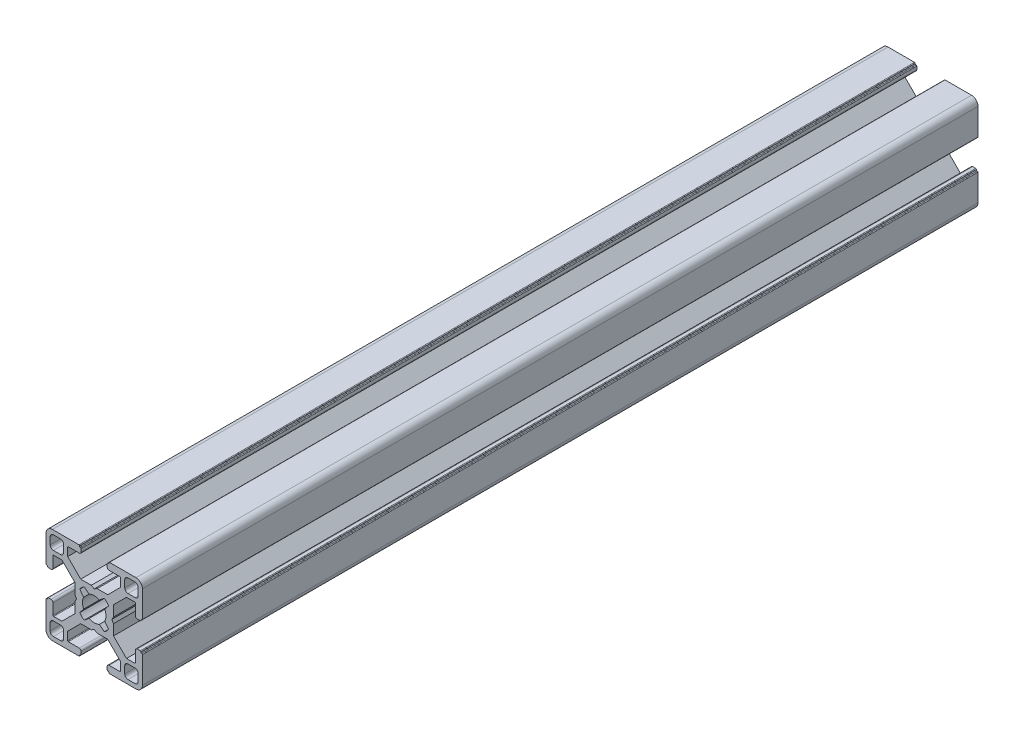
from build123d import *

# Parameters (mm, degrees)
BASE_EXTRUDE_DEPTH = 260


with BuildPart() as part:
    # Sketch1 → Base-Extrude (new body)
    with BuildSketch(Plane.XY):
        with BuildLine():
            Line((6.00446543, 0.899999619), (5.484852164, 0))
            Line((5.484852164, 0), (6.00446543, -0.899999619))
            Line((6.00446543, -0.899999619), (6.00446543, -4.204465866))
            Line((6.00446543, -4.204465866), (10.049999564, -8.25))
            Line((10.049999564, -8.25), (12.59999928, -8.25))
            ThreePointArc((12.59999928, -8.25), (12.741420837, -8.191421273), (12.799999564, -8.049999716))
            Line((12.799999564, -8.049999716), (12.799999564, -4.649999613))
            ThreePointArc((12.799999564, -4.649999613), (12.975735606, -4.225735278), (13.39999994, -4.049999237))
            Line((13.39999994, -4.049999237), (14.300000043, -4.049999237))
            ThreePointArc((14.300000043, -4.049999237), (14.4414216, -4.108577964), (14.500000327, -4.249999521))
            Line((14.500000327, -4.249999521), (14.500000327, -4.349998953))
            ThreePointArc((14.500000327, -4.349998953), (14.558579054, -4.49142051), (14.700000611, -4.549999237))
            Line((14.700000611, -4.549999237), (14.799999716, -4.549999237))
            ThreePointArc((14.799999716, -4.549999237), (14.941421273, -4.608577964), (15, -4.749999521))
            Line((15, -4.749999521), (15, -13.000000346))
            ThreePointArc((15, -13.000000346), (14.414213664, -14.414213664), (13.000000346, -15))
            Line((13.000000346, -15), (4.749999945, -15))
            ThreePointArc((4.749999945, -15), (4.60857832, -14.941421245), (4.549999564, -14.799999619))
            Line((4.549999564, -14.799999619), (4.549999564, -14.69999942))
            ThreePointArc((4.549999564, -14.69999942), (4.49142109, -14.558578474), (4.350000144, -14.5))
            Line((4.350000144, -14.5), (4.250000374, -14.5))
            ThreePointArc((4.250000374, -14.5), (4.108578753, -14.441421247), (4.05, -14.299999626))
            Line((4.05, -14.299999626), (4.05, -13.399999434))
            ThreePointArc((4.05, -13.399999434), (4.225735989, -12.975735226), (4.650000197, -12.799999237))
            Line((4.650000197, -12.799999237), (8.049999924, -12.799999237))
            ThreePointArc((8.049999924, -12.799999237), (8.191421565, -12.741420475), (8.250000327, -12.599998834))
            Line((8.250000327, -12.599998834), (8.250000327, -10.049999237))
            Line((8.250000327, -10.049999237), (4.204466193, -6))
            Line((4.204466193, -6), (0.899999946, -6))
            Line((0.899999946, -6), (0, -5.484851837))
            Line((0, -5.484851837), (-0.899999946, -6))
            Line((-0.899999946, -6), (-4.204466193, -6))
            Line((-4.204466193, -6), (-8.250000327, -10.049999237))
            Line((-8.250000327, -10.049999237), (-8.250000327, -12.599998834))
            ThreePointArc((-8.250000327, -12.599998834), (-8.191421565, -12.741420475), (-8.049999924, -12.799999237))
            Line((-8.049999924, -12.799999237), (-4.650000197, -12.799999237))
            ThreePointArc((-4.650000197, -12.799999237), (-4.225735989, -12.975735226), (-4.05, -13.399999434))
            Line((-4.05, -13.399999434), (-4.05, -14.299999626))
            ThreePointArc((-4.05, -14.299999626), (-4.108578753, -14.441421247), (-4.250000374, -14.5))
            Line((-4.250000374, -14.5), (-4.350000144, -14.5))
            ThreePointArc((-4.350000144, -14.5), (-4.49142109, -14.558578474), (-4.549999564, -14.69999942))
            Line((-4.549999564, -14.69999942), (-4.549999564, -14.799999619))
            ThreePointArc((-4.549999564, -14.799999619), (-4.60857832, -14.941421245), (-4.749999945, -15))
            Line((-4.749999945, -15), (-13.000000346, -15))
            ThreePointArc((-13.000000346, -15), (-14.414213664, -14.414213664), (-15, -13.000000346))
            Line((-15, -13.000000346), (-15, -4.749999521))
            ThreePointArc((-15, -4.749999521), (-14.941421273, -4.608577964), (-14.799999716, -4.549999237))
            Line((-14.799999716, -4.549999237), (-14.700000611, -4.549999237))
            ThreePointArc((-14.700000611, -4.549999237), (-14.558579054, -4.49142051), (-14.500000327, -4.349998953))
            Line((-14.500000327, -4.349998953), (-14.500000327, -4.249999521))
            ThreePointArc((-14.500000327, -4.249999521), (-14.4414216, -4.108577964), (-14.300000043, -4.049999237))
            Line((-14.300000043, -4.049999237), (-13.39999994, -4.049999237))
            ThreePointArc((-13.39999994, -4.049999237), (-12.975735606, -4.225735278), (-12.799999564, -4.649999613))
            Line((-12.799999564, -4.649999613), (-12.799999564, -8.049999716))
            ThreePointArc((-12.799999564, -8.049999716), (-12.741420837, -8.191421273), (-12.59999928, -8.25))
            Line((-12.59999928, -8.25), (-10.049999564, -8.25))
            Line((-10.049999564, -8.25), (-6.00446543, -4.204465866))
            Line((-6.00446543, -4.204465866), (-6.00446543, -0.899999619))
            Line((-6.00446543, -0.899999619), (-5.484852164, 0))
            Line((-5.484852164, 0), (-6.00446543, 0.899999619))
            Line((-6.00446543, 0.899999619), (-6.00446543, 4.204465866))
            Line((-6.00446543, 4.204465866), (-10.049999564, 8.25))
            Line((-10.049999564, 8.25), (-12.59999928, 8.25))
            ThreePointArc((-12.59999928, 8.25), (-12.741420837, 8.191421273), (-12.799999564, 8.049999716))
            Line((-12.799999564, 8.049999716), (-12.799999564, 4.649999613))
            ThreePointArc((-12.799999564, 4.649999613), (-12.975735606, 4.225735278), (-13.39999994, 4.049999237))
            Line((-13.39999994, 4.049999237), (-14.300000043, 4.049999237))
            ThreePointArc((-14.300000043, 4.049999237), (-14.4414216, 4.108577964), (-14.500000327, 4.249999521))
            Line((-14.500000327, 4.249999521), (-14.500000327, 4.349998953))
            ThreePointArc((-14.500000327, 4.349998953), (-14.558579054, 4.49142051), (-14.700000611, 4.549999237))
            Line((-14.700000611, 4.549999237), (-14.799999716, 4.549999237))
            ThreePointArc((-14.799999716, 4.549999237), (-14.941421273, 4.608577964), (-15, 4.749999521))
            Line((-15, 4.749999521), (-15, 13.000000346))
            ThreePointArc((-15, 13.000000346), (-14.414213664, 14.414213664), (-13.000000346, 15))
            Line((-13.000000346, 15), (-4.749999945, 15))
            ThreePointArc((-4.749999945, 15), (-4.60857832, 14.941421245), (-4.549999564, 14.799999619))
            Line((-4.549999564, 14.799999619), (-4.549999564, 14.69999942))
            ThreePointArc((-4.549999564, 14.69999942), (-4.49142109, 14.558578474), (-4.350000144, 14.5))
            Line((-4.350000144, 14.5), (-4.250000374, 14.5))
            ThreePointArc((-4.250000374, 14.5), (-4.108578753, 14.441421247), (-4.05, 14.299999626))
            Line((-4.05, 14.299999626), (-4.05, 13.399999434))
            ThreePointArc((-4.05, 13.399999434), (-4.225735989, 12.975735226), (-4.650000197, 12.799999237))
            Line((-4.650000197, 12.799999237), (-8.049999924, 12.799999237))
            ThreePointArc((-8.049999924, 12.799999237), (-8.191421565, 12.741420475), (-8.250000327, 12.599998834))
            Line((-8.250000327, 12.599998834), (-8.250000327, 10.049999237))
            Line((-8.250000327, 10.049999237), (-4.204466193, 6))
            Line((-4.204466193, 6), (-0.899999946, 6))
            Line((-0.899999946, 6), (0, 5.484851837))
            Line((0, 5.484851837), (0.899999946, 6))
            Line((0.899999946, 6), (4.204466193, 6))
            Line((4.204466193, 6), (8.250000327, 10.049999237))
            Line((8.250000327, 10.049999237), (8.250000327, 12.599998834))
            ThreePointArc((8.250000327, 12.599998834), (8.191421565, 12.741420475), (8.049999924, 12.799999237))
            Line((8.049999924, 12.799999237), (4.650000197, 12.799999237))
            ThreePointArc((4.650000197, 12.799999237), (4.225735989, 12.975735226), (4.05, 13.399999434))
            Line((4.05, 13.399999434), (4.05, 14.299999626))
            ThreePointArc((4.05, 14.299999626), (4.108578753, 14.441421247), (4.250000374, 14.5))
            Line((4.250000374, 14.5), (4.350000144, 14.5))
            ThreePointArc((4.350000144, 14.5), (4.49142109, 14.558578474), (4.549999564, 14.69999942))
            Line((4.549999564, 14.69999942), (4.549999564, 14.799999619))
            ThreePointArc((4.549999564, 14.799999619), (4.60857832, 14.941421245), (4.749999945, 15))
            Line((4.749999945, 15), (13.000000346, 15))
            ThreePointArc((13.000000346, 15), (14.414213664, 14.414213664), (15, 13.000000346))
            Line((15, 13.000000346), (15, 4.749999521))
            ThreePointArc((15, 4.749999521), (14.941421273, 4.608577964), (14.799999716, 4.549999237))
            Line((14.799999716, 4.549999237), (14.700000611, 4.549999237))
            ThreePointArc((14.700000611, 4.549999237), (14.558579054, 4.49142051), (14.500000327, 4.349998953))
            Line((14.500000327, 4.349998953), (14.500000327, 4.249999521))
            ThreePointArc((14.500000327, 4.249999521), (14.4414216, 4.108577964), (14.300000043, 4.049999237))
            Line((14.300000043, 4.049999237), (13.39999994, 4.049999237))
            ThreePointArc((13.39999994, 4.049999237), (12.975735606, 4.225735278), (12.799999564, 4.649999613))
            Line((12.799999564, 4.649999613), (12.799999564, 8.049999716))
            ThreePointArc((12.799999564, 8.049999716), (12.741420837, 8.191421273), (12.59999928, 8.25))
            Line((12.59999928, 8.25), (10.049999564, 8.25))
            Line((10.049999564, 8.25), (6.00446543, 4.204465866))
            Line((6.00446543, 4.204465866), (6.00446543, 0.899999619))
        make_face()
        with BuildLine():
            Line((13.70000109, 12.700000398), (13.70000109, 10.499999635))
            ThreePointArc((13.70000109, 10.499999635), (13.407107874, 9.792892851), (12.70000109, 9.499999635))
            Line((12.70000109, 9.499999635), (10.500000327, 9.499999635))
            ThreePointArc((10.500000327, 9.499999635), (9.792893543, 9.792892851), (9.500000327, 10.499999635))
            Line((9.500000327, 10.499999635), (9.500000327, 12.700000398))
            ThreePointArc((9.500000327, 12.700000398), (9.792893543, 13.407107182), (10.500000327, 13.700000398))
            Line((10.500000327, 13.700000398), (12.70000109, 13.700000398))
            ThreePointArc((12.70000109, 13.700000398), (13.407107874, 13.407107182), (13.70000109, 12.700000398))
        make_face(mode=Mode.SUBTRACT)
        with BuildLine():
            Line((3.135929412, 4.518400903), (1.600129524, 3.280561767))
            ThreePointArc((1.600129524, 3.280561767), (0, 3.65), (-1.600129524, 3.280561767))
            Line((-1.600129524, 3.280561767), (-3.135929412, 4.518400903))
            ThreePointArc((-3.135929412, 4.518400903), (-3.881002259, 3.897155561), (-4.505336892, 3.154669473))
            Line((-4.505336892, 3.154669473), (-3.280561732, 1.600129597))
            ThreePointArc((-3.280561732, 1.600129597), (-3.65, 0), (-3.280561732, -1.600129597))
            Line((-3.280561732, -1.600129597), (-4.505336892, -3.154669473))
            ThreePointArc((-4.505336892, -3.154669473), (-3.881002259, -3.897155561), (-3.135929412, -4.518400903))
            Line((-3.135929412, -4.518400903), (-1.600129524, -3.280561767))
            ThreePointArc((-1.600129524, -3.280561767), (0, -3.65), (1.600129524, -3.280561767))
            Line((1.600129524, -3.280561767), (3.135929412, -4.518400903))
            ThreePointArc((3.135929412, -4.518400903), (3.881002259, -3.897155561), (4.505336892, -3.154669473))
            Line((4.505336892, -3.154669473), (3.280561732, -1.600129597))
            ThreePointArc((3.280561732, -1.600129597), (3.65, 0), (3.280561732, 1.600129597))
            Line((3.280561732, 1.600129597), (4.505336892, 3.154669473))
            ThreePointArc((4.505336892, 3.154669473), (3.881002259, 3.897155561), (3.135929412, 4.518400903))
        make_face(mode=Mode.SUBTRACT)
        with BuildLine():
            Line((-13.70000109, -12.700000398), (-13.70000109, -10.499999635))
            ThreePointArc((-13.70000109, -10.499999635), (-13.407107874, -9.792892851), (-12.70000109, -9.499999635))
            Line((-12.70000109, -9.499999635), (-10.500000327, -9.499999635))
            ThreePointArc((-10.500000327, -9.499999635), (-9.792893543, -9.792892851), (-9.500000327, -10.499999635))
            Line((-9.500000327, -10.499999635), (-9.500000327, -12.700000398))
            ThreePointArc((-9.500000327, -12.700000398), (-9.792893543, -13.407107182), (-10.500000327, -13.700000398))
            Line((-10.500000327, -13.700000398), (-12.70000109, -13.700000398))
            ThreePointArc((-12.70000109, -13.700000398), (-13.407107874, -13.407107182), (-13.70000109, -12.700000398))
        make_face(mode=Mode.SUBTRACT)
        with BuildLine():
            Line((10.500000327, -13.700000398), (12.70000109, -13.700000398))
            ThreePointArc((12.70000109, -13.700000398), (13.407107874, -13.407107182), (13.70000109, -12.700000398))
            Line((13.70000109, -12.700000398), (13.70000109, -10.499999635))
            ThreePointArc((13.70000109, -10.499999635), (13.407107874, -9.792892851), (12.70000109, -9.499999635))
            Line((12.70000109, -9.499999635), (10.500000327, -9.499999635))
            ThreePointArc((10.500000327, -9.499999635), (9.792893543, -9.792892851), (9.500000327, -10.499999635))
            Line((9.500000327, -10.499999635), (9.500000327, -12.700000398))
            ThreePointArc((9.500000327, -12.700000398), (9.792893543, -13.407107182), (10.500000327, -13.700000398))
        make_face(mode=Mode.SUBTRACT)
        with BuildLine():
            Line((-10.500000327, 13.700000398), (-12.70000109, 13.700000398))
            ThreePointArc((-12.70000109, 13.700000398), (-13.407107874, 13.407107182), (-13.70000109, 12.700000398))
            Line((-13.70000109, 12.700000398), (-13.70000109, 10.499999635))
            ThreePointArc((-13.70000109, 10.499999635), (-13.407107874, 9.792892851), (-12.70000109, 9.499999635))
            Line((-12.70000109, 9.499999635), (-10.500000327, 9.499999635))
            ThreePointArc((-10.500000327, 9.499999635), (-9.792893543, 9.792892851), (-9.500000327, 10.499999635))
            Line((-9.500000327, 10.499999635), (-9.500000327, 12.700000398))
            ThreePointArc((-9.500000327, 12.700000398), (-9.792893543, 13.407107182), (-10.500000327, 13.700000398))
        make_face(mode=Mode.SUBTRACT)
    extrude(amount=-BASE_EXTRUDE_DEPTH)


solid = part.part
